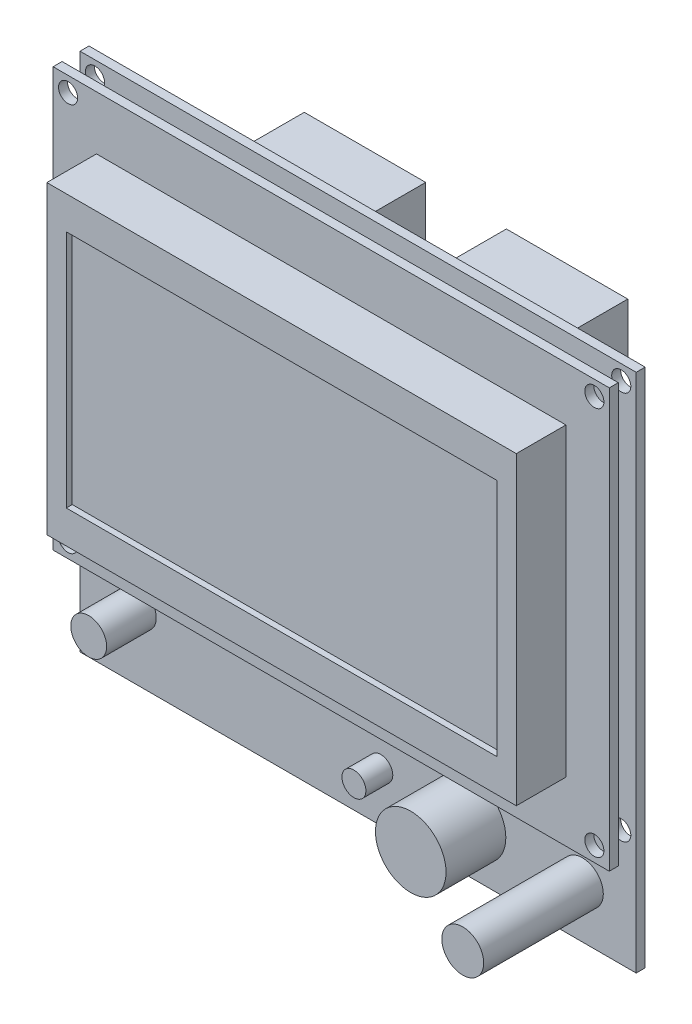
from build123d import *

# Parameters (mm, degrees)
ESBO_O1_W                  = 93
ESBO_O1_H                  = 87
RESSALTO_EXTRUS_O1_DEPTH   = 1.5
RESSALTO_EXTRUS_O2_START   = 3
ESBO_O3_W                  = 93
ESBO_O3_H                  = 70
RESSALTO_EXTRUS_O2_DEPTH   = 1.5
ESBO_O4_W                  = 78.5
ESBO_O4_H                  = 51
RESSALTO_EXTRUS_O3_DEPTH   = 8.3
ESBO_O5_W                  = 72
ESBO_O5_H                  = 40
CORTE_EXTRUS_O1_DEPTH      = 1
ESBO_O6_R                  = 3.5
RESSALTO_EXTRUS_O4_DEPTH   = 20
ESBO_O7_R                  = 2
RESSALTO_EXTRUS_O5_DEPTH   = 4.5
ESBO_O8_R                  = 5.9
RESSALTO_EXTRUS_O6_DEPTH   = 10
ESBO_O9_R                  = 3
RESSALTO_EXTRUS_O7_DEPTH   = 8.3
CORTE_EXTRUS_O2_DEPTH      = 66.534342142
CORTE_EXTRUS_O2_DEPTH_BACK = 66.534342142
ESBO_O10_R                 = 1.6
ESBO_O11_W                 = 20.3
ESBO_O11_H                 = 8.6
RESSALTO_EXTRUS_O8_DEPTH   = 15
ESBO_O12_W                 = 25.5
ESBO_O12_H                 = 26.5
RESSALTO_EXTRUS_O9_DEPTH   = 3


with BuildPart() as part:
    # Esboço1 → Ressalto-extrusão1 (new body)
    with BuildSketch(Plane.XY):
        Rectangle(ESBO_O1_W, ESBO_O1_H)
    extrude(amount=RESSALTO_EXTRUS_O1_DEPTH)

    # Esboço6 → Ressalto-extrusão4 (add)
    with BuildSketch(Plane.XY.offset(1.5)):
        with Locations((37.5, -34.8)):
            Circle(ESBO_O6_R)
    extrude(amount=RESSALTO_EXTRUS_O4_DEPTH)

    # Esboço7 → Ressalto-extrusão5 (add)
    with BuildSketch(Plane.XY.offset(1.5)):
        with Locations((3.8, -35.2)):
            Circle(ESBO_O7_R)
    extrude(amount=RESSALTO_EXTRUS_O5_DEPTH)

    # Esboço8 → Ressalto-extrusão6 (add)
    with BuildSketch(Plane.XY.offset(1.5)):
        with Locations((18.8, -34.8)):
            Circle(ESBO_O8_R)
    extrude(amount=RESSALTO_EXTRUS_O6_DEPTH)

    # Esboço9 → Ressalto-extrusão7 (add)
    with BuildSketch(Plane.XY.offset(1.5)):
        with Locations(Location((-36.75, -32.2, 0), (0, 0, 180))):
            Circle(ESBO_O9_R)
    extrude(amount=RESSALTO_EXTRUS_O7_DEPTH)


with BuildPart() as body_2:
    # Esboço3 → Ressalto-extrusão2 (new body)
    with BuildSketch(Plane.XY.offset(1.5).offset(RESSALTO_EXTRUS_O2_START)):
        with Locations((0, 8.5)):
            Rectangle(ESBO_O3_W, ESBO_O3_H)
    extrude(amount=RESSALTO_EXTRUS_O2_DEPTH)

    # Esboço4 → Ressalto-extrusão3 (add)
    with BuildSketch(Plane.XY.offset(6)):
        with Locations((0, 9)):
            Rectangle(ESBO_O4_W, ESBO_O4_H)
    extrude(amount=RESSALTO_EXTRUS_O3_DEPTH)

    # Esboço5 → Corte-extrusão1 (cut)
    with BuildSketch(Plane.XY.offset(14.3)):
        with Locations((0, 9)):
            Rectangle(ESBO_O5_W, ESBO_O5_H)
    extrude(amount=-CORTE_EXTRUS_O1_DEPTH, mode=Mode.SUBTRACT)


with BuildPart() as corte_extrus_o2_tool:
    # Esboço10 → Corte-extrusão2 (new, two sides: drawn at the far end of the back side and taken through both)
    with BuildSketch(Plane.XY.offset(6).offset(-CORTE_EXTRUS_O2_DEPTH_BACK)):
        with Locations((-44, 41)):
            Circle(ESBO_O10_R)
        with Locations((44, 41)):
            Circle(ESBO_O10_R)
        with Locations((44, -24)):
            Circle(ESBO_O10_R)
        with Locations((-44, -24)):
            Circle(ESBO_O10_R)
    extrude(amount=CORTE_EXTRUS_O2_DEPTH + CORTE_EXTRUS_O2_DEPTH_BACK)


with BuildPart() as part_1:
    add(part.part)

    # Corte-extrusão2: cut by corte_extrus_o2_tool
    add(corte_extrus_o2_tool.part, mode=Mode.SUBTRACT)

    # Esboço11 → Ressalto-extrusão8 (add)
    with BuildSketch(Plane(origin=(0, 0, 0), x_dir=(-1, 0, 0), z_dir=(0, 0, -1))):
        with Locations((-18.438731824, 32.6)):
            Rectangle(ESBO_O11_W, ESBO_O11_H)
        with Locations((15.35, 32.6)):
            Rectangle(ESBO_O11_W, ESBO_O11_H)
    extrude(amount=RESSALTO_EXTRUS_O8_DEPTH)

    # Esboço12 → Ressalto-extrusão9 (add)
    with BuildSketch(Plane(origin=(0, 0, 0), x_dir=(-1, 0, 0), z_dir=(0, 0, -1))):
        with Locations((33.65, 8.25)):
            Rectangle(ESBO_O12_W, ESBO_O12_H)
    extrude(amount=RESSALTO_EXTRUS_O9_DEPTH)


with BuildPart() as body_2_1:
    add(body_2.part)

    # Corte-extrusão2: cut by corte_extrus_o2_tool
    add(corte_extrus_o2_tool.part, mode=Mode.SUBTRACT)


solid = Compound([part_1.part, body_2_1.part])
